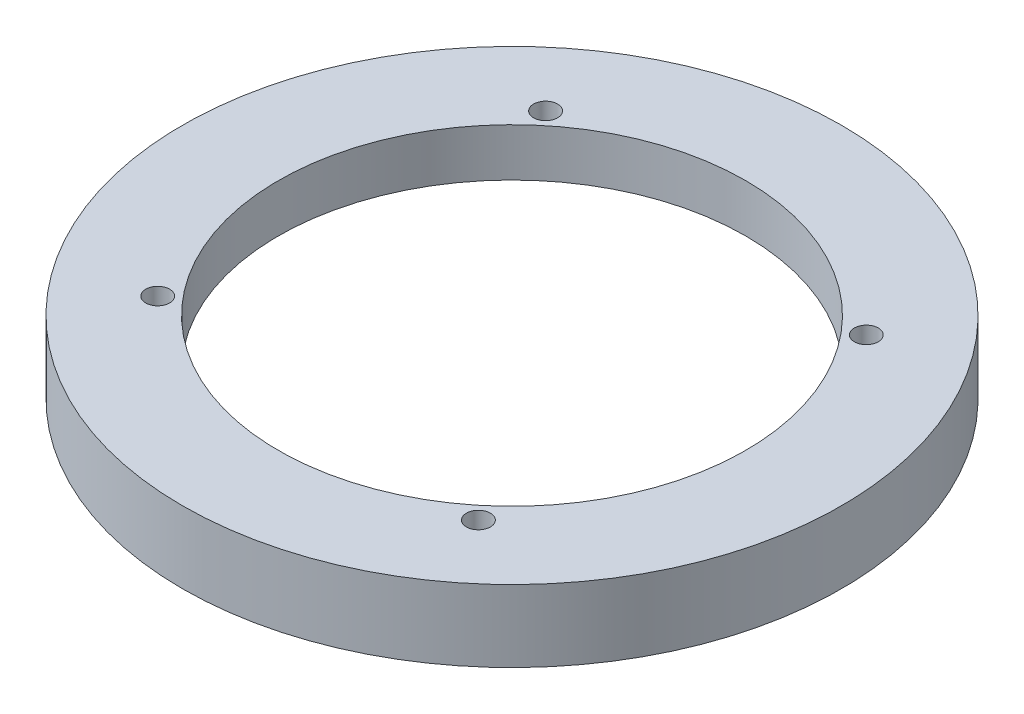
from build123d import *

# Parameters (mm, degrees)
SKETCH_2_R               = 137.5
SKETCH_2_R_2             = 117.5
EXTRUDE_1_DEPTH          = 10
SKETCH_3_R               = 137.5
EXTRUDE_2_DEPTH          = 20
SKETCH_4_R               = 97.5
CUT_EXTRUDE_1_DEPTH      = 196.480178023
CUT_EXTRUDE_2_DEPTH      = 197.7549237
CUT_EXTRUDE_2_DEPTH_BACK = 197.7549237
SKETCH_6_R               = 5


with BuildPart() as part:
    # 草图2 → 凸台-拉伸1 (new body)
    with BuildSketch(Plane(origin=(0, 0, 0), x_dir=(1, 0, 0), z_dir=(0, 1, 0))):
        with Locations(Location((0, 0, 0), (0, 0, 270))):
            Circle(SKETCH_2_R)
        with Locations(Location((0, 0, 0), (0, 0, 270))):
            Circle(SKETCH_2_R_2, mode=Mode.SUBTRACT)
    extrude(amount=EXTRUDE_1_DEPTH)

    # 草图3 → 凸台-拉伸2 (add)
    with BuildSketch(Plane(origin=(0, 10, 0), x_dir=(1, 0, 0), z_dir=(0, 1, 0))):
        with Locations(Location((0, 0, 0), (0, 0, 270))):
            Circle(SKETCH_3_R)
    extrude(amount=EXTRUDE_2_DEPTH)

    # 草图4 → 切除-拉伸1 (cut, through all)
    with BuildSketch(Plane.XZ.offset(-10)):
        with Locations(Location((0, 0, 0), (0, 0, 270))):
            Circle(SKETCH_4_R)
    extrude(amount=-CUT_EXTRUDE_1_DEPTH, mode=Mode.SUBTRACT)

    # 草图6 → 切除-拉伸2 (cut, two sides: drawn at the far end of the back side and taken through both)
    with BuildSketch(Plane(origin=(0, 30, 0), x_dir=(1, 0, 0), z_dir=(0, 1, 0)).offset(-CUT_EXTRUDE_2_DEPTH_BACK)):
        with Locations(Location((80.922446863, 66.907081792, 0), (0, 0, 270))):
            Circle(SKETCH_6_R)
        with Locations(Location((66.907081793, -80.922446862, 0), (0, 0, 270))):
            Circle(SKETCH_6_R)
        with Locations(Location((-80.922446861, -66.907081792, 0), (0, 0, 270))):
            Circle(SKETCH_6_R)
        with Locations(Location((-66.907081791, 80.922446862, 0), (0, 0, 270))):
            Circle(SKETCH_6_R)
    extrude(amount=CUT_EXTRUDE_2_DEPTH + CUT_EXTRUDE_2_DEPTH_BACK, mode=Mode.SUBTRACT)


solid = part.part
